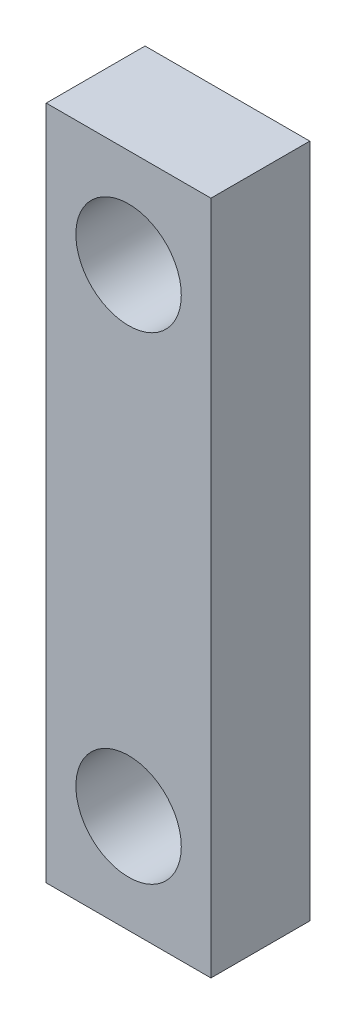
from build123d import *

# Parameters (mm, degrees)
SKETCH1_W           = 5
SKETCH1_H           = 20.5
SKETCH1_R           = 1.6
BOSS_EXTRUDE1_DEPTH = 3


with BuildPart() as part:
    # Sketch1 → Boss-Extrude1 (new body)
    with BuildSketch(Plane.XY):
        Rectangle(SKETCH1_W, SKETCH1_H)
        with Locations((0, -7.25)):
            Circle(SKETCH1_R, mode=Mode.SUBTRACT)
        with Locations((0, 7.25)):
            Circle(SKETCH1_R, mode=Mode.SUBTRACT)
    extrude(amount=BOSS_EXTRUDE1_DEPTH)


solid = part.part
